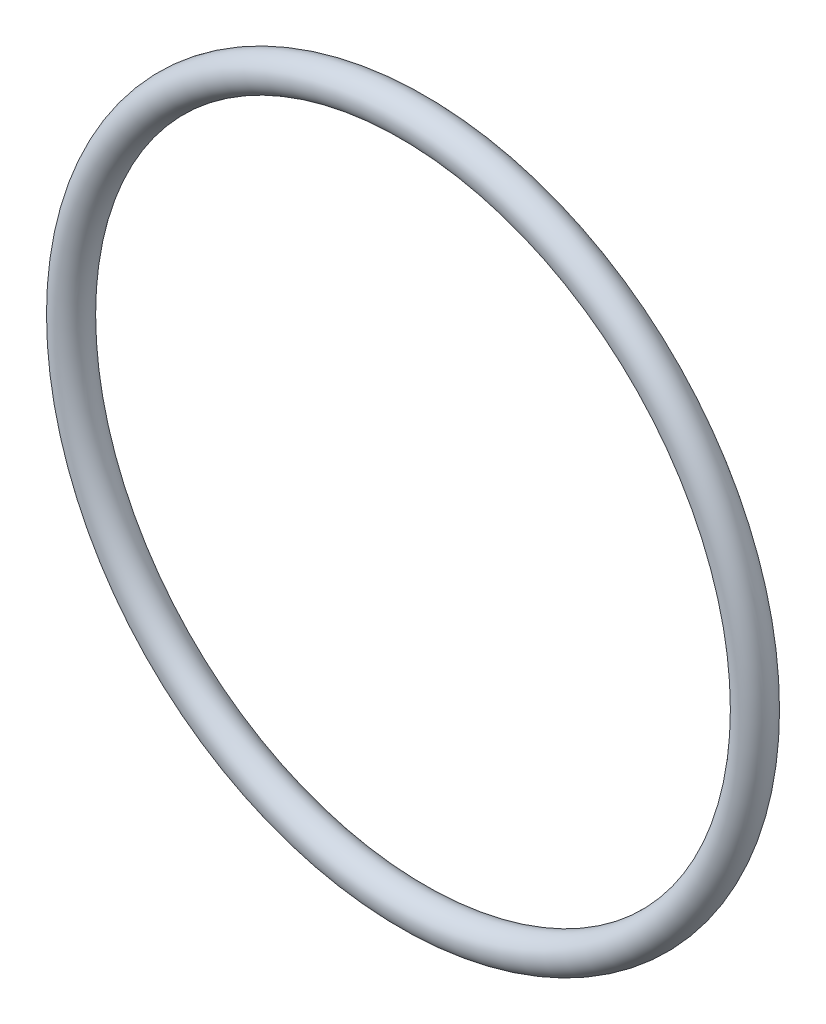
from build123d import *

# Parameters (mm, degrees)
SKETCH1_R = 1.5


with BuildPart() as part:
    # Sketch1 → Revolve1 (revolve)
    with BuildSketch(Plane(origin=(0, 0, 0), x_dir=(0, -1, 0), z_dir=(1, 0, 0)), mode=Mode.PRIVATE) as revolve1_sk:
        with Locations((29.5, 0)):
            Circle(SKETCH1_R)
    revolve(revolve1_sk.sketch.rotate(Axis((0, 0, 1.5), (0, 0, -1)), 270), axis=Axis((0, 0, 1.5), (0, 0, -1)))


solid = part.part
